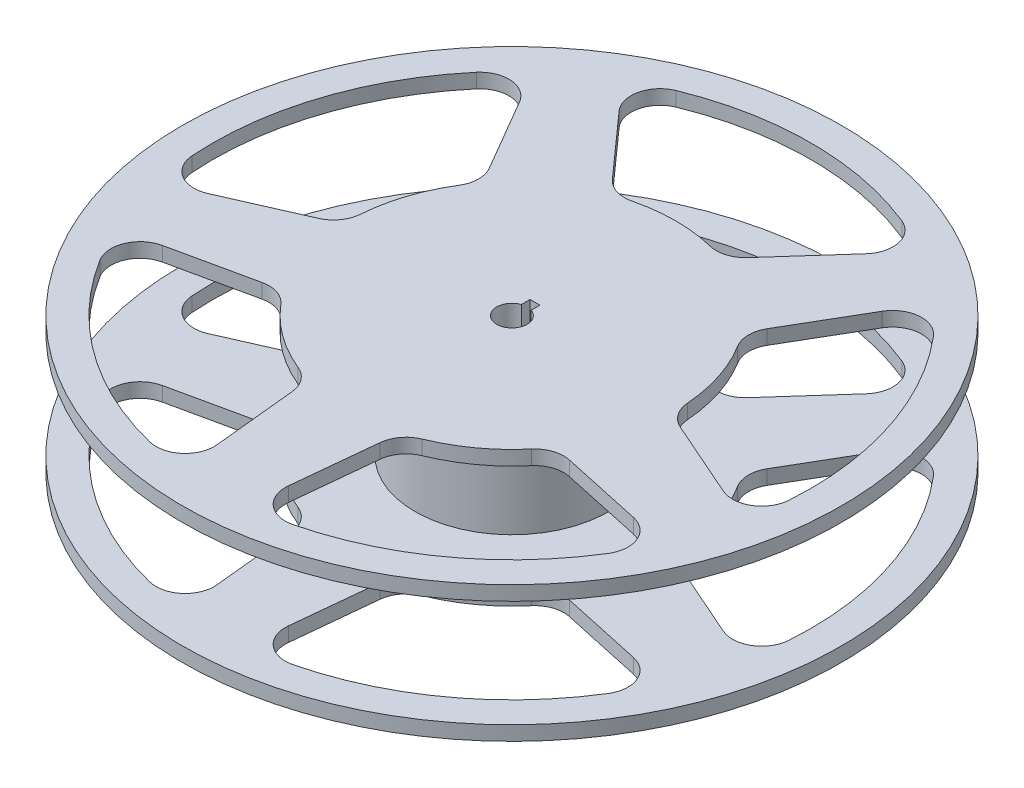
from build123d import *

# Parameters (mm, degrees)
CUT_EXTRUDE1_DEPTH = 128.2030377
CIRPATTERN1_COUNT  = 5
CUT_EXTRUDE2_DEPTH = 128.2030377


with BuildPart() as part:
    # Sketch1 → Revolve1 (revolve)
    with BuildSketch(Plane.XY, mode=Mode.PRIVATE) as revolve1_sk:
        Polygon((0, 0), (86.36, 0), (86.36, 3.78), (25.4, 3.78), (25.4, 31.78), (86.36, 31.78), (86.36, 35.56), (0, 35.56), align=None)
    revolve(revolve1_sk.sketch.rotate(Axis((0, 35.56, 0), (0, -1, 0)), 180), axis=Axis((0, 35.56, 0), (0, -1, 0)))

    # Sketch2 → Cut-Extrude1 (cut, through all)
    with BuildSketch(Plane(origin=(0, 35.56, 0), x_dir=(1, 0, 0), z_dir=(0, 1, 0))):
        with BuildLine():
            Line((-32.38324098, 60.461396247), (-17.736798391, 44.055966634))
            ThreePointArc((-17.736798391, 44.055966634), (-14.309566496, 41.852699526), (-10.237061566, 41.730192332))
            ThreePointArc((-10.237061566, 41.730192332), (0, 42.967503786), (10.237061566, 41.730192332))
            ThreePointArc((10.237061566, 41.730192332), (14.309566496, 41.852699526), (17.736798391, 44.055966634))
            Line((17.736798391, 44.055966634), (32.38324098, 60.461396247))
            ThreePointArc((32.38324098, 60.461396247), (34.12253228, 67.255277706), (29.573893077, 72.593052609))
            ThreePointArc((29.573893077, 72.593052609), (0, 78.386009204), (-29.573893077, 72.593052609))
            ThreePointArc((-29.573893077, 72.593052609), (-34.12253228, 67.255277706), (-32.38324098, 60.461396247))
        make_face()
    cut_extrude1 = extrude(amount=-CUT_EXTRUDE1_DEPTH, mode=Mode.SUBTRACT)

    # CirPattern1: Cut-Extrude1 ×5 about axis
    cirpattern1_axis = Axis((0, 0, 0), (0, 1, 0))
    for i in range(1, CIRPATTERN1_COUNT):
        add(cut_extrude1.rotate(cirpattern1_axis, i * 360 / CIRPATTERN1_COUNT), mode=Mode.SUBTRACT)

    # Sketch3 → Cut-Extrude2 (cut, through all)
    with BuildSketch(Plane(origin=(0, 35.56, 0), x_dir=(1, 0, 0), z_dir=(0, 1, 0))):
        with BuildLine():
            Line((-1.2891518, 3.753540222), (-1.2891518, 6.049382139))
            Line((-1.2891518, 6.049382139), (1.2891518, 6.049382139))
            Line((1.2891518, 6.049382139), (1.2891518, 3.753540222))
            ThreePointArc((1.2891518, 3.753540222), (0, -3.96875), (-1.2891518, 3.753540222))
        make_face()
    extrude(amount=-CUT_EXTRUDE2_DEPTH, mode=Mode.SUBTRACT)


solid = part.part
